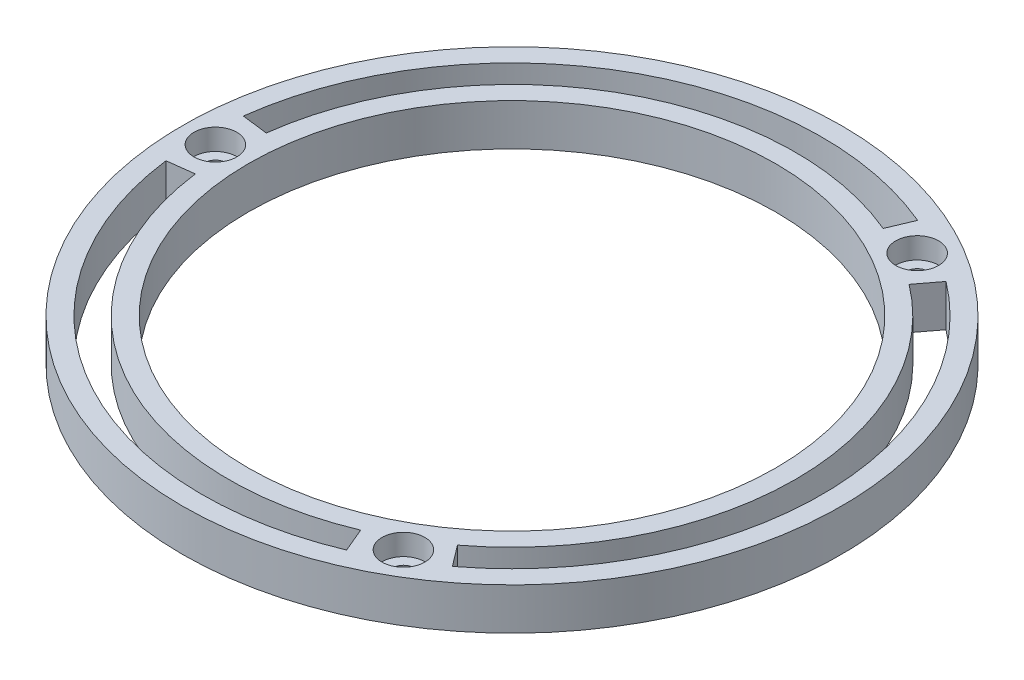
from build123d import *

# Parameters (mm, degrees)
BOSS_EXTRUDE1_DEPTH = 6.35
M3_HOLES_REACH      = 72.995
SKETCH2_R           = 1.65
SKETCH3_R           = 3.25
CUT_EXTRUDE1_DEPTH  = 3.2


with BuildPart() as part:
    # Sketch1 → Boss-Extrude1 (new body)
    with BuildSketch(Plane(origin=(0, 0, 0), x_dir=(1, 0, 0), z_dir=(0, 1, 0))):
        with BuildLine():
            ThreePointArc((50, 0), (44.781853835, 22.239279825), (30.216577315, 39.83664714))
            Line((30.216577315, 39.83664714), (28.403582676, 37.446448312))
            ThreePointArc((28.403582676, 37.446448312), (42.094942605, 20.904923035), (47, 0))
            ThreePointArc((47, 0), (42.094942605, -20.904923035), (28.403582676, -37.446448312))
            Line((28.403582676, -37.446448312), (30.216577315, -39.83664714))
            ThreePointArc((30.216577315, -39.83664714), (44.781853835, -22.239279825), (50, 0))
        make_face()
        with BuildLine():
            ThreePointArc((43, 0), (38.512394298, 19.125780649), (25.986256491, 34.259516541))
            Line((25.986256491, 34.259516541), (24.173261852, 31.869317712))
            ThreePointArc((24.173261852, 31.869317712), (35.825483068, 17.79142386), (40, 0))
            ThreePointArc((40, 0), (35.825483068, -17.79142386), (24.173261852, -31.869317712))
            Line((24.173261852, -31.869317712), (25.986256491, -34.259516541))
            ThreePointArc((25.986256491, -34.259516541), (38.512394298, -19.125780649), (43, 0))
        make_face()
        with BuildLine():
            ThreePointArc((16.6764834, -39.634516541), (21.5, -37.239092363), (25.986256491, -34.259516541))
            Line((25.986256491, -34.259516541), (24.173261852, -31.869317712))
            ThreePointArc((24.173261852, -31.869317712), (20, -34.641016151), (15.513007814, -36.869317712))
            Line((15.513007814, -36.869317712), (16.6764834, -39.634516541))
        make_face()
        with BuildLine():
            ThreePointArc((18.227784182, -43.321448312), (23.5, -40.703193978), (28.403582676, -37.446448312))
            Line((28.403582676, -37.446448312), (25.986256491, -34.259516541))
            ThreePointArc((25.986256491, -34.259516541), (21.5, -37.239092363), (16.6764834, -39.634516541))
            Line((16.6764834, -39.634516541), (18.227784182, -43.321448312))
        make_face()
        with BuildLine():
            ThreePointArc((19.391259768, -46.08664714), (25, -43.301270189), (30.216577315, -39.83664714))
            Line((30.216577315, -39.83664714), (28.403582676, -37.446448312))
            ThreePointArc((28.403582676, -37.446448312), (23.5, -40.703193978), (18.227784182, -43.321448312))
            Line((18.227784182, -43.321448312), (19.391259768, -46.08664714))
        make_face()
        with BuildLine():
            ThreePointArc((-49.607837082, -6.25), (-25, -43.301270189), (19.391259768, -46.08664714))
            Line((19.391259768, -46.08664714), (18.227784182, -43.321448312))
            ThreePointArc((18.227784182, -43.321448312), (-23.5, -40.703193978), (-46.631366858, -5.875))
            Line((-46.631366858, -5.875), (-49.607837082, -6.25))
        make_face()
        with BuildLine():
            ThreePointArc((-42.662739891, -5.375), (-21.5, -37.239092363), (16.6764834, -39.634516541))
            Line((16.6764834, -39.634516541), (15.513007814, -36.869317712))
            ThreePointArc((15.513007814, -36.869317712), (-20, -34.641016151), (-39.686269666, -5))
            Line((-39.686269666, -5), (-42.662739891, -5.375))
        make_face()
        with BuildLine():
            Line((-39.686269666, 5), (-42.662739891, 5.375))
            ThreePointArc((-42.662739891, 5.375), (-43, 0), (-42.662739891, -5.375))
            Line((-42.662739891, -5.375), (-39.686269666, -5))
            ThreePointArc((-39.686269666, -5), (-40, 0), (-39.686269666, 5))
        make_face()
        with BuildLine():
            Line((-42.662739891, 5.375), (-46.631366858, 5.875))
            ThreePointArc((-46.631366858, 5.875), (-47, 0), (-46.631366858, -5.875))
            Line((-46.631366858, -5.875), (-42.662739891, -5.375))
            ThreePointArc((-42.662739891, -5.375), (-43, 0), (-42.662739891, 5.375))
        make_face()
        with BuildLine():
            Line((-46.631366858, 5.875), (-49.607837082, 6.25))
            ThreePointArc((-49.607837082, 6.25), (-50, 0), (-49.607837082, -6.25))
            Line((-49.607837082, -6.25), (-46.631366858, -5.875))
            ThreePointArc((-46.631366858, -5.875), (-47, 0), (-46.631366858, 5.875))
        make_face()
        with BuildLine():
            Line((18.227784182, 43.321448312), (19.391259768, 46.08664714))
            ThreePointArc((19.391259768, 46.08664714), (-25, 43.301270189), (-49.607837082, 6.25))
            Line((-49.607837082, 6.25), (-46.631366858, 5.875))
            ThreePointArc((-46.631366858, 5.875), (-23.5, 40.703193978), (18.227784182, 43.321448312))
        make_face()
        with BuildLine():
            Line((15.513007814, 36.869317712), (16.6764834, 39.634516541))
            ThreePointArc((16.6764834, 39.634516541), (-21.5, 37.239092363), (-42.662739891, 5.375))
            Line((-42.662739891, 5.375), (-39.686269666, 5))
            ThreePointArc((-39.686269666, 5), (-20, 34.641016151), (15.513007814, 36.869317712))
        make_face()
        with BuildLine():
            Line((24.173261852, 31.869317712), (25.986256491, 34.259516541))
            ThreePointArc((25.986256491, 34.259516541), (21.5, 37.239092363), (16.6764834, 39.634516541))
            Line((16.6764834, 39.634516541), (15.513007814, 36.869317712))
            ThreePointArc((15.513007814, 36.869317712), (20, 34.641016151), (24.173261852, 31.869317712))
        make_face()
        with BuildLine():
            Line((25.986256491, 34.259516541), (28.403582676, 37.446448312))
            ThreePointArc((28.403582676, 37.446448312), (23.5, 40.703193978), (18.227784182, 43.321448312))
            Line((18.227784182, 43.321448312), (16.6764834, 39.634516541))
            ThreePointArc((16.6764834, 39.634516541), (21.5, 37.239092363), (25.986256491, 34.259516541))
        make_face()
        with BuildLine():
            Line((28.403582676, 37.446448312), (30.216577315, 39.83664714))
            ThreePointArc((30.216577315, 39.83664714), (25, 43.301270189), (19.391259768, 46.08664714))
            Line((19.391259768, 46.08664714), (18.227784182, 43.321448312))
            ThreePointArc((18.227784182, 43.321448312), (23.5, 40.703193978), (28.403582676, 37.446448312))
        make_face()
    extrude(amount=BOSS_EXTRUDE1_DEPTH)

    # Sketch2 → M3-holes (cut, up to next)
    with BuildSketch(Plane(origin=(0, 6.35, 0), x_dir=(1, 0, 0), z_dir=(0, 1, 0)), mode=Mode.PRIVATE) as m3_holes_sk1:
        with Locations(Location((-45, 0, 0), (0, 0, 270))):
            Circle(SKETCH2_R)
    m3_holes_tool1 = extrude(m3_holes_sk1.sketch, amount=-M3_HOLES_REACH, mode=Mode.PRIVATE) & part.part
    # Sketch2 → M3-holes (cut, up to next)
    with BuildSketch(Plane(origin=(0, 6.35, 0), x_dir=(1, 0, 0), z_dir=(0, 1, 0)), mode=Mode.PRIVATE) as m3_holes_sk2:
        with Locations(Location((22.5, -38.97114317, 0), (0, 0, 270))):
            Circle(SKETCH2_R)
    m3_holes_tool2 = extrude(m3_holes_sk2.sketch, amount=-M3_HOLES_REACH, mode=Mode.PRIVATE) & part.part
    # Sketch2 → M3-holes (cut, up to next)
    with BuildSketch(Plane(origin=(0, 6.35, 0), x_dir=(1, 0, 0), z_dir=(0, 1, 0)), mode=Mode.PRIVATE) as m3_holes_sk3:
        with Locations(Location((22.5, 38.97114317, 0), (0, 0, 270))):
            Circle(SKETCH2_R)
    m3_holes_tool3 = extrude(m3_holes_sk3.sketch, amount=-M3_HOLES_REACH, mode=Mode.PRIVATE) & part.part
    add(m3_holes_tool1.solids().sort_by_distance((-45, 6.35, 0))[0], mode=Mode.SUBTRACT)
    add(m3_holes_tool2.solids().sort_by_distance((22.5, 6.35, 38.971143))[0], mode=Mode.SUBTRACT)
    add(m3_holes_tool3.solids().sort_by_distance((22.5, 6.35, -38.971143))[0], mode=Mode.SUBTRACT)

    # Sketch3 → Cut-Extrude1 (cut)
    with BuildSketch(Plane(origin=(0, 6.35, 0), x_dir=(1, 0, 0), z_dir=(0, 1, 0))):
        with Locations(Location((-45, 0, 0), (0, 0, 270))):
            Circle(SKETCH3_R)
        with Locations(Location((22.5, 38.97114317, 0), (0, 0, 270))):
            Circle(SKETCH3_R)
        with Locations(Location((22.5, -38.97114317, 0), (0, 0, 270))):
            Circle(SKETCH3_R)
    extrude(amount=-CUT_EXTRUDE1_DEPTH, mode=Mode.SUBTRACT)


solid = part.part
